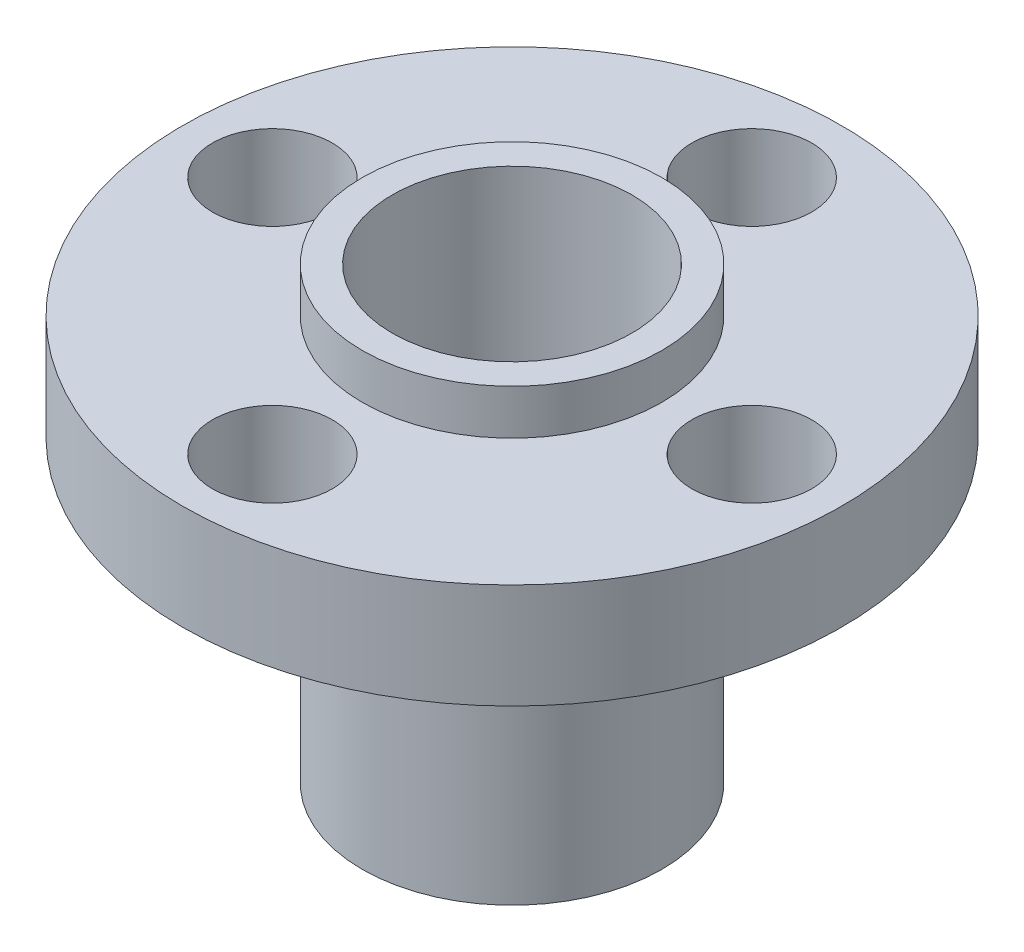
from build123d import *

# Parameters (mm, degrees)
SKETCH_1_R      = 11
SKETCH_1_R_2    = 2
SKETCH_1_R_3    = 5
EXTRUDE_1_DEPTH = 3.5
SKETCH_1_3_R    = 5
SKETCH_1_3_R_2  = 4
EXTRUDE_2_DEPTH = 5
EXTRUDE_START   = -10
SKETCH_1_4_R    = 5
SKETCH_1_4_R_2  = 4
EXTRUDE_3_DEPTH = 10


with BuildPart() as part:
    # 草图1 → 凸台-拉伸1 (new body)
    with BuildSketch(Plane(origin=(0, 0, 0), x_dir=(1, 0, 0), z_dir=(0, 1, 0))):
        Circle(SKETCH_1_R)
        with Locations((0, -8)):
            Circle(SKETCH_1_R_2, mode=Mode.SUBTRACT)
        with Locations((-8, 0)):
            Circle(SKETCH_1_R_2, mode=Mode.SUBTRACT)
        Circle(SKETCH_1_R_3, mode=Mode.SUBTRACT)
        with Locations((8, 0)):
            Circle(SKETCH_1_R_2, mode=Mode.SUBTRACT)
        with Locations((0, 8)):
            Circle(SKETCH_1_R_2, mode=Mode.SUBTRACT)
    extrude(amount=EXTRUDE_1_DEPTH)

    # 草图1<3> → 凸台-拉伸2 (add)
    with BuildSketch(Plane(origin=(0, 0, 0), x_dir=(1, 0, 0), z_dir=(0, 1, 0))):
        Circle(SKETCH_1_3_R)
        Circle(SKETCH_1_3_R_2, mode=Mode.SUBTRACT)
    extrude(amount=EXTRUDE_2_DEPTH)

    # 草图1<4> → 凸台-拉伸3 (add)
    with BuildSketch(Plane(origin=(0, 0, 0), x_dir=(1, 0, 0), z_dir=(0, 1, 0)).offset(EXTRUDE_START)):
        Circle(SKETCH_1_4_R)
        Circle(SKETCH_1_4_R_2, mode=Mode.SUBTRACT)
    extrude(amount=EXTRUDE_3_DEPTH)


solid = part.part
